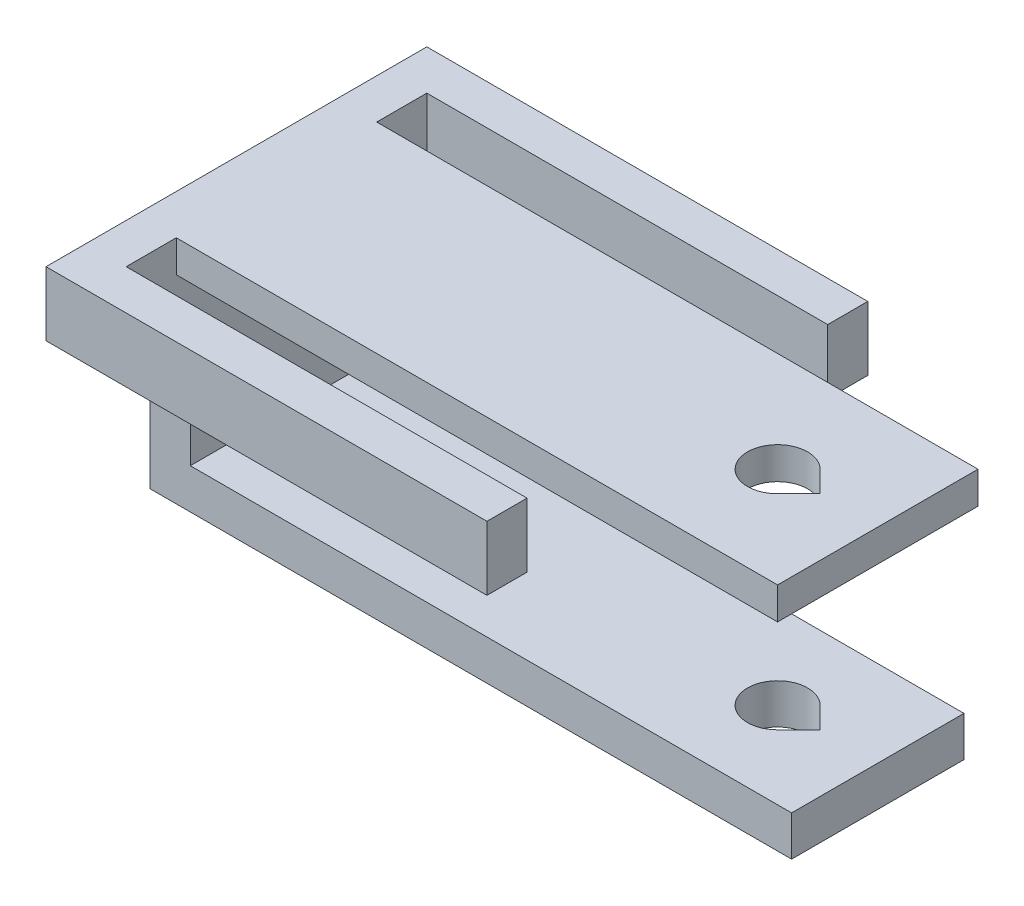
from build123d import *

# Parameters (mm, degrees)
SKETCH_1_W          = 20
SKETCH_1_H          = 10
EXTRUDE_1_DEPTH     = 1.6
EXTRUDE_2_DEPTH     = 2
SKETCH_3_W          = 2
SKETCH_3_H          = 3.2
SKETCH_3_W_2        = 8.6
SKETCH_3_H_2        = 2
EXTRUDE_3_DEPTH     = 20
SKETCH_4_W          = 8.6
SKETCH_4_H          = 2
SKETCH_4_W_2        = 10
SKETCH_4_H_2        = 1.6
EXTRUDE_4_DEPTH     = 10
CUT_EXTRUDE_3_DEPTH = 15


with BuildPart() as part:
    # Эскиз1 → Бобышка-Вытянуть1 (new body)
    with BuildSketch(Plane(origin=(0, 0, 0), x_dir=(1, 0, 0), z_dir=(0, 1, 0))):
        with Locations((10, 5)):
            Rectangle(SKETCH_1_W, SKETCH_1_H)
    extrude(amount=EXTRUDE_1_DEPTH)

    # Эскиз2 → Бобышка-Вытянуть2 (add)
    with BuildSketch(Plane.ZY):
        Polygon((-14.5, 1.6), (4.5, 1.6), (4.5, -1.6), (-0.7, -1.6), (-0.7, -10.6), (-9.3, -10.6), (-9.3, -1.6), (-14.5, -1.6), align=None)
    extrude(amount=EXTRUDE_2_DEPTH)

    # Эскиз3 → Бобышка-Вытянуть3 (add)
    with BuildSketch(Plane(origin=(0, 0, 0), x_dir=(0, 0, -1), z_dir=(1, 0, 0))):
        with Locations((-3.5, 0)):
            Rectangle(SKETCH_3_W, SKETCH_3_H)
        with Locations((13.5, 0)):
            Rectangle(SKETCH_3_W, SKETCH_3_H)
        with Locations((5, -9.6)):
            Rectangle(SKETCH_3_W_2, SKETCH_3_H_2)
    extrude(amount=EXTRUDE_3_DEPTH)

    # Эскиз4 → Бобышка-Вытянуть4 (add)
    with BuildSketch(Plane(origin=(20, 0, 0), x_dir=(0, 0, -1), z_dir=(1, 0, 0))):
        with Locations((5, -9.6)):
            Rectangle(SKETCH_4_W, SKETCH_4_H)
        with Locations((5, 0.8)):
            Rectangle(SKETCH_4_W_2, SKETCH_4_H_2)
    extrude(amount=EXTRUDE_4_DEPTH)

    # Эскиз5 → Вырез-Вытянуть3 (cut)
    with BuildSketch(Plane.XZ.offset(10.6)):
        with BuildLine():
            Line((26.060660172, -6.060660172), (27.121320344, -5))
            Line((27.121320344, -5), (26.060660172, -3.939339828))
            ThreePointArc((26.060660172, -3.939339828), (23.5, -5), (26.060660172, -6.060660172))
        make_face()
    extrude(amount=-CUT_EXTRUDE_3_DEPTH, mode=Mode.SUBTRACT)


solid = part.part
